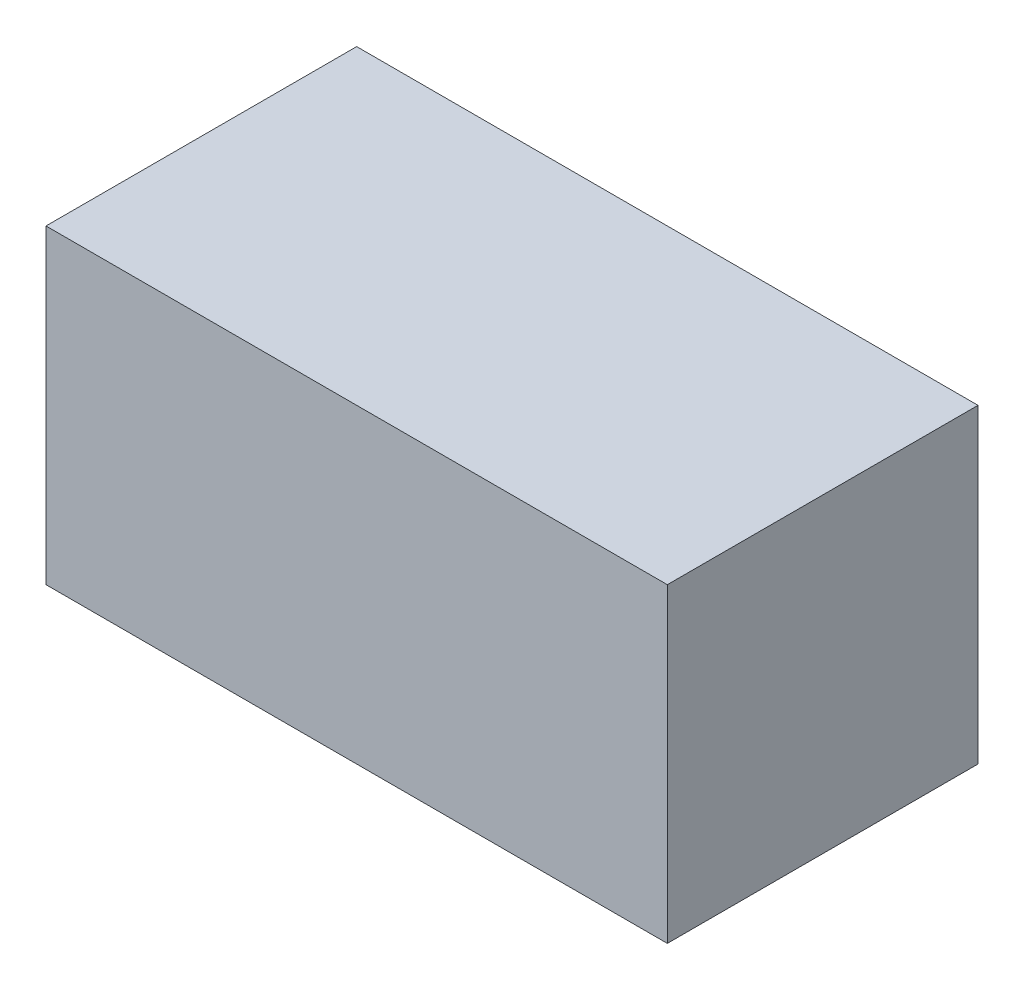
from build123d import *

# Parameters (mm, degrees)
SKETCH1_W           = 1.016
SKETCH1_H           = 0.508
BOSS_EXTRUDE1_DEPTH = 0.508


with BuildPart() as part:
    # Sketch1 → Boss-Extrude1 (new body)
    with BuildSketch(Plane(origin=(0, 0, 0), x_dir=(1, 0, 0), z_dir=(0, 1, 0))):
        with Locations((0.508, 0.254)):
            Rectangle(SKETCH1_W, SKETCH1_H)
    extrude(amount=BOSS_EXTRUDE1_DEPTH)


solid = part.part
